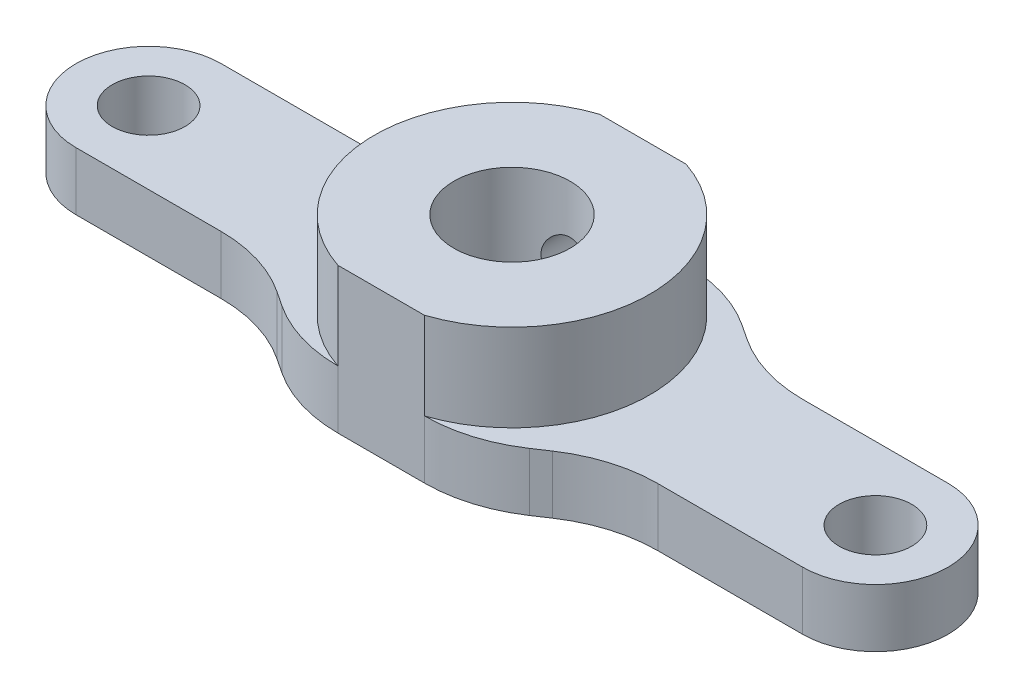
from build123d import *

# Parameters (mm, degrees)
BOSS_EXTRUDE1_DEPTH = 4
SKETCH4_R           = 4
BOSS_EXTRUDE3_DEPTH = 6
CUT_EXTRUDE1_DEPTH  = 6


with BuildPart() as part:
    # Sketch1 → Boss-Extrude1 (new body)
    with BuildSketch(Plane(origin=(0, 0, 0), x_dir=(1, 0, 0), z_dir=(0, 1, 0))):
        with BuildLine():
            Line((-9.972243623, -5), (0, -5))
            ThreePointArc((0, -5), (3.535533906, -3.535533906), (5, 0))
            Line((5, 0), (2.5, 0))
            ThreePointArc((2.5, 0), (0, -2.5), (-2.5, 0))
            Line((-2.5, 0), (-21, 0))
            ThreePointArc((-21, 0), (-25, -4), (-29, 0))
            Line((-29, 0), (-47.5, 0))
            ThreePointArc((-47.5, 0), (-50, -2.5), (-52.5, 0))
            Line((-52.5, 0), (-55, 0))
            ThreePointArc((-55, 0), (-53.535533906, -3.535533906), (-50, -5))
            Line((-50, -5), (-40.027756377, -5))
            Line((-40.027756377, -5), (-9.972243623, -5))
        make_face()
        with BuildLine():
            Line((2.5, 0), (5, 0))
            ThreePointArc((5, 0), (3.535533906, 3.535533906), (0, 5))
            Line((0, 5), (-9.972243623, 5))
            Line((-9.972243623, 5), (-25, 5))
            Line((-25, 5), (-40.027756377, 5))
            Line((-40.027756377, 5), (-50, 5))
            ThreePointArc((-50, 5), (-53.535533906, 3.535533906), (-55, 0))
            Line((-55, 0), (-52.5, 0))
            ThreePointArc((-52.5, 0), (-50, 2.5), (-47.5, 0))
            Line((-47.5, 0), (-29, 0))
            ThreePointArc((-29, 0), (-25, 4), (-21, 0))
            Line((-21, 0), (-2.5, 0))
            ThreePointArc((-2.5, 0), (0, 2.5), (2.5, 0))
        make_face()
        with BuildLine():
            ThreePointArc((-15.519245585, -6.679497057), (-12.87008511, -5.429079735), (-9.972243623, -5))
            Line((-9.972243623, -5), (-40.027756377, -5))
            ThreePointArc((-40.027756377, -5), (-37.12991489, -5.429079735), (-34.480754415, -6.679497057))
            Line((-34.480754415, -6.679497057), (-33.519245585, -7.320502943))
            ThreePointArc((-33.519245585, -7.320502943), (-30.87008511, -8.570920265), (-27.972243623, -9))
            Line((-27.972243623, -9), (-22.027756377, -9))
            ThreePointArc((-22.027756377, -9), (-19.12991489, -8.570920265), (-16.480754415, -7.320502943))
            Line((-16.480754415, -7.320502943), (-15.519245585, -6.679497057))
        make_face()
        with BuildLine():
            Line((-25, 5), (-9.972243623, 5))
            ThreePointArc((-9.972243623, 5), (-12.87008511, 5.429079735), (-15.519245585, 6.679497057))
            Line((-15.519245585, 6.679497057), (-16.480754415, 7.320502943))
            ThreePointArc((-16.480754415, 7.320502943), (-19.12991489, 8.570920265), (-22.027756377, 9))
            Line((-22.027756377, 9), (-25, 9))
            Line((-25, 9), (-25, 5))
        make_face()
        with BuildLine():
            Line((-40.027756377, 5), (-25, 5))
            Line((-25, 5), (-25, 9))
            Line((-25, 9), (-27.972243623, 9))
            ThreePointArc((-27.972243623, 9), (-30.87008511, 8.570920265), (-33.519245585, 7.320502943))
            Line((-33.519245585, 7.320502943), (-34.480754415, 6.679497057))
            ThreePointArc((-34.480754415, 6.679497057), (-37.12991489, 5.429079735), (-40.027756377, 5))
        make_face()
    extrude(amount=BOSS_EXTRUDE1_DEPTH)

    # Sketch4 → Boss-Extrude3 (add)
    with BuildSketch(Plane(origin=(0, 4, 0), x_dir=(1, 0, 0), z_dir=(0, 1, 0))):
        with BuildLine():
            ThreePointArc((-15.521907779, 0), (-17.31867748, 5.552613483), (-22.027756377, 9))
            Line((-22.027756377, 9), (-27.972243623, 9))
            ThreePointArc((-27.972243623, 9), (-34.478092221, 0), (-27.972243623, -9))
            Line((-27.972243623, -9), (-22.027756377, -9))
            ThreePointArc((-22.027756377, -9), (-17.31867748, -5.552613483), (-15.521907779, 0))
        make_face()
        with Locations(Location((-25, 0, 0), (0, 0, 270))):
            Circle(SKETCH4_R, mode=Mode.SUBTRACT)
    extrude(amount=BOSS_EXTRUDE3_DEPTH)

    # Sketch5 → Cut-Extrude1 (cut)
    with BuildSketch(Plane(origin=(0, 0, -9), x_dir=(-1, 0, 0), z_dir=(0, 0, -1))):
        with BuildLine():
            ThreePointArc((26.65, 5), (26.166726189, 6.166726189), (25, 6.65))
            Line((25, 6.65), (25, 3.35))
            ThreePointArc((25, 3.35), (26.166726189, 3.833273811), (26.65, 5))
        make_face()
        with BuildLine():
            Line((25, 3.35), (25, 6.65))
            ThreePointArc((25, 6.65), (23.35, 5), (25, 3.35))
        make_face()
    extrude(amount=-CUT_EXTRUDE1_DEPTH, mode=Mode.SUBTRACT)


solid = part.part
